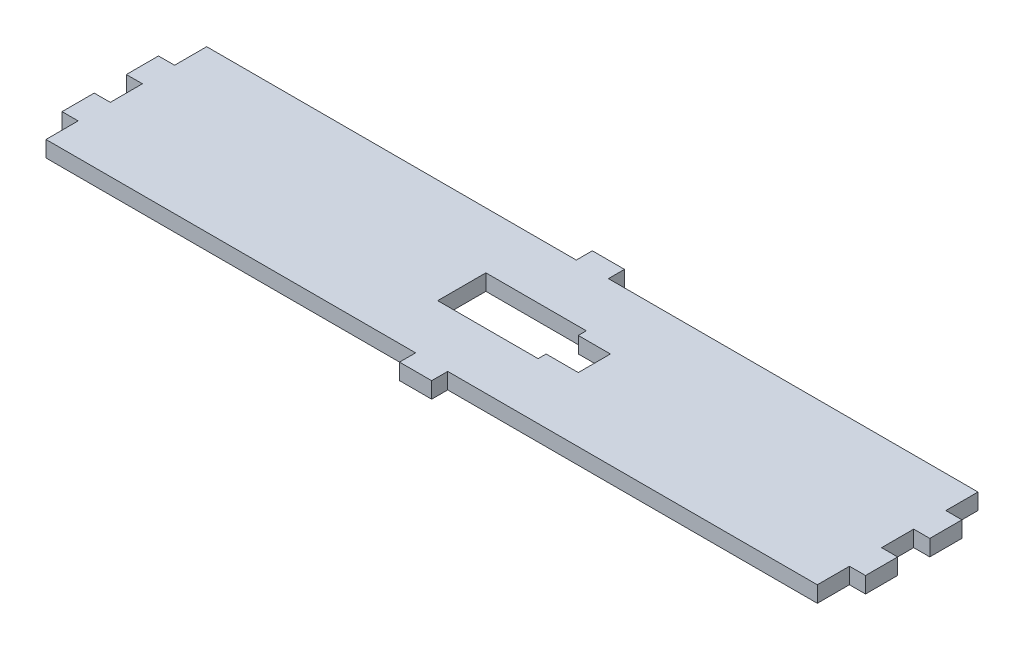
from build123d import *

# Parameters (mm, degrees)
BOSS_EXTRUDE1_DEPTH = 6.35


with BuildPart() as part:
    # Sketch1 → Boss-Extrude1 (new body)
    with BuildSketch(Plane(origin=(0, 0, 0), x_dir=(1, 0, 0), z_dir=(0, 1, 0))):
        Polygon((0, 0), (146.05, 0), (146.05, -6.35), (158.75, -6.35), (158.75, 0), (304.8, 0), (304.8, 12.7), (311.15, 12.7), (311.15, 25.4), (304.8, 25.4), (304.8, 38.1), (311.15, 38.1), (311.15, 50.8), (304.8, 50.8), (304.8, 63.5), (158.75, 63.5), (158.75, 69.85), (146.05, 69.85), (146.05, 63.5), (0, 63.5), (0, 50.8), (-6.35, 50.8), (-6.35, 38.1), (0, 38.1), (0, 25.4), (-6.35, 25.4), (-6.35, 12.7), (0, 12.7), align=None)
        Polygon((132.55625, 22.225), (132.55625, 41.275), (172.24375, 41.275), (172.24375, 38.1), (184.94375, 38.1), (184.94375, 25.4), (172.24375, 25.4), (172.24375, 22.225), align=None, mode=Mode.SUBTRACT)
    extrude(amount=BOSS_EXTRUDE1_DEPTH)


solid = part.part
